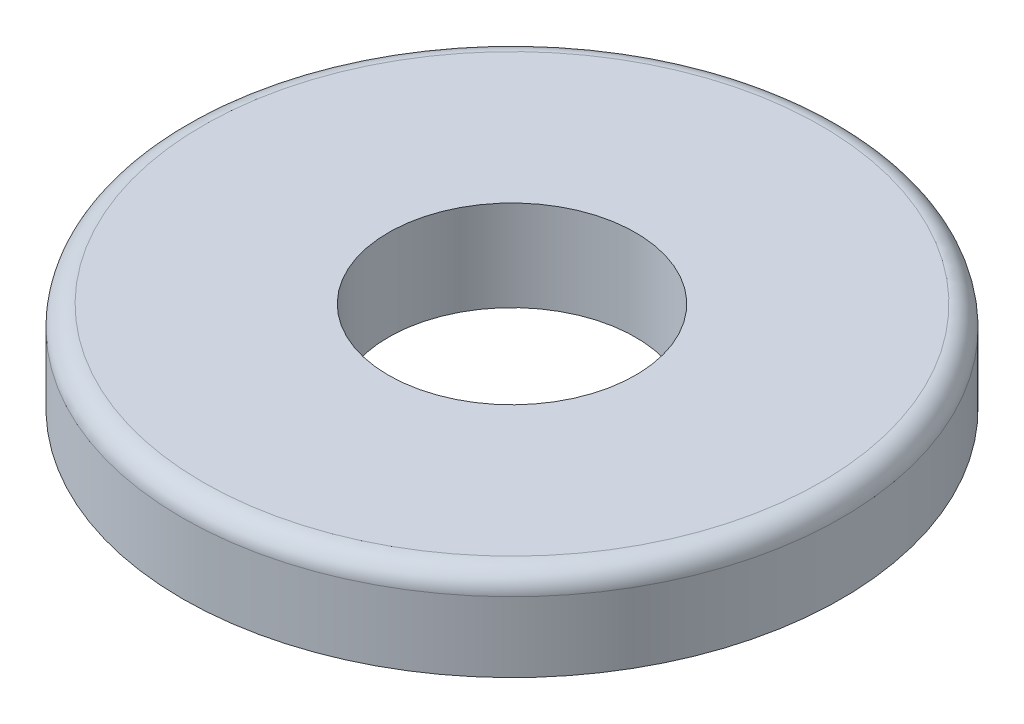
from build123d import *

# Parameters (mm, degrees)
CROQUIS_BASE_R          = 4
SALIENTE_EXTRUIR3_DEPTH = 1.1
CROQUIS_BARRENO_R       = 1.5
CORTAR_EXTRUIR1_DEPTH   = 6.762811814
REDONDEO1_R             = 0.25


with BuildPart() as part:
    # Croquis base → Saliente-Extruir3 (new body)
    with BuildSketch(Plane(origin=(0, 0, 0), x_dir=(1, 0, 0), z_dir=(0, 1, 0))):
        with Locations(Location((0, 0, 0), (0, 0, 270))):
            Circle(CROQUIS_BASE_R)
    extrude(amount=SALIENTE_EXTRUIR3_DEPTH)

    # Croquis barreno → Cortar-Extruir1 (cut, through all)
    with BuildSketch(Plane(origin=(0, 1.1, 0), x_dir=(1, 0, 0), z_dir=(0, 1, 0))):
        with Locations(Location((0, 0, 0), (0, 0, 270))):
            Circle(CROQUIS_BARRENO_R)
    extrude(amount=-CORTAR_EXTRUIR1_DEPTH, mode=Mode.SUBTRACT)

    # Redondeo1
    redondeo1_edges = [part.edges().sort_by_distance(p)[0] for p in [
        (0, 1.1, -4),
    ]]
    fillet(redondeo1_edges, radius=REDONDEO1_R)


solid = part.part
